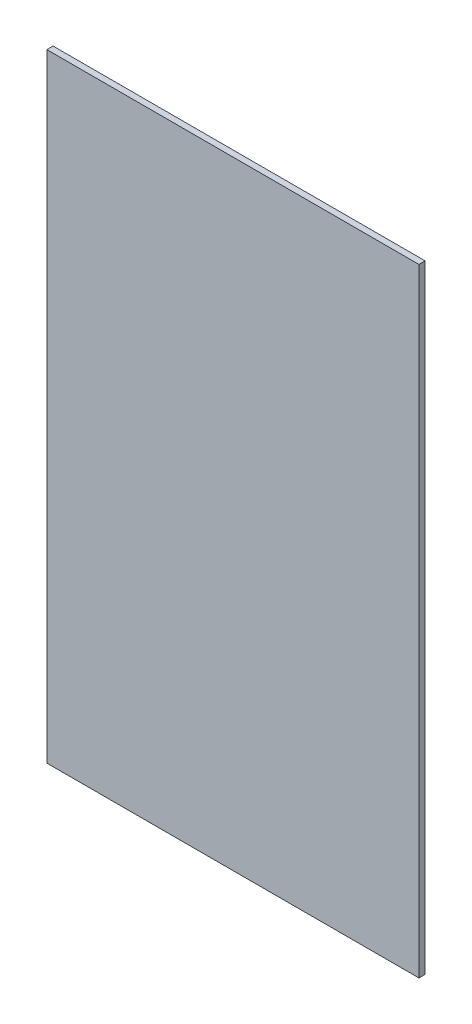
from build123d import *

# Parameters (mm, degrees)
SKETCH_1_W      = 480
SKETCH_1_H      = 797
EXTRUDE_1_DEPTH = 8


with BuildPart() as part:
    # 草图1 → 凸台-拉伸1 (new body)
    with BuildSketch(Plane.XY):
        with Locations((24.864864865, -181.639588955)):
            Rectangle(SKETCH_1_W, SKETCH_1_H)
    extrude(amount=EXTRUDE_1_DEPTH)


solid = part.part
